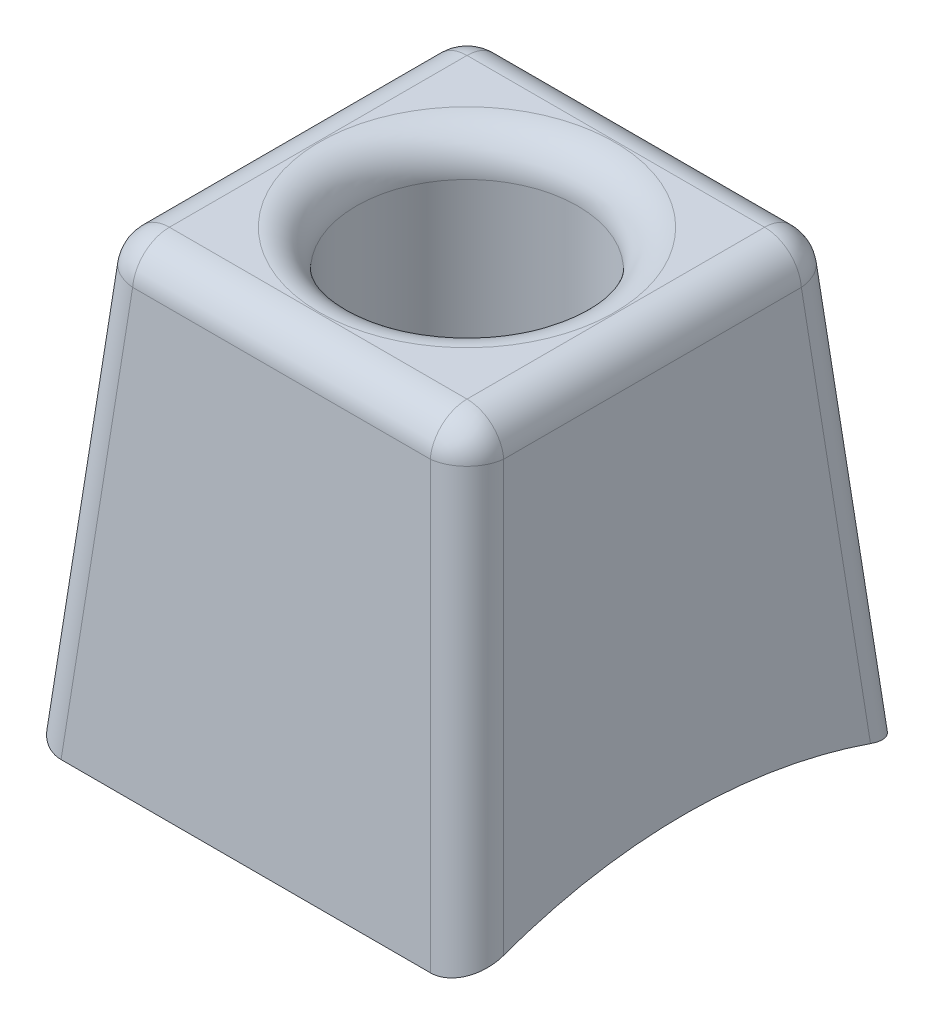
from build123d import *

# Parameters (mm, degrees)
SKETCH1_W           = 12
SKETCH1_H           = 12
BOSS_EXTRUDE1_DEPTH = 12
BOSS_EXTRUDE1_TAPER = 5
SKETCH2_R           = 3
CUT_EXTRUDE1_DEPTH  = 21.784609864
FILLET1_R           = 1
SKETCH3_R           = 16
CUT_EXTRUDE2_DEPTH  = 21.784609864


with BuildPart() as part:
    # Sketch1 → Boss-Extrude1 (new body)
    with BuildSketch(Plane(origin=(0, 0, 0), x_dir=(1, 0, 0), z_dir=(0, 1, 0))):
        with Locations((-6, 6)):
            Rectangle(SKETCH1_W, SKETCH1_H)
    extrude(amount=BOSS_EXTRUDE1_DEPTH, taper=BOSS_EXTRUDE1_TAPER)

    # Sketch2 → Cut-Extrude1 (cut, through all)
    with BuildSketch(Plane(origin=(0, 12, 0), x_dir=(1, 0, 0), z_dir=(0, 1, 0))):
        with Locations(Location((-6, 6, 0), (0, 0, 270))):
            Circle(SKETCH2_R)
    extrude(amount=-CUT_EXTRUDE1_DEPTH, mode=Mode.SUBTRACT)

    # Fillet1
    fillet1_edges = [part.edges().sort_by_distance(p)[0] for p in [
        (-10.950136038, 12, -6),
        (-6, 12, -1.049863962),
        (-6, 12, -9),
        (-1.049863962, 12, -6),
        (-6, 12, -10.950136038),
        (-0.524931981, 6, -0.524931981),
        (-11.475068019, 6, -0.524931981),
        (-11.475068019, 6, -11.475068019),
        (-0.524931981, 6, -11.475068019),
    ]]
    fillet(fillet1_edges, radius=FILLET1_R)

    # Sketch3 → Cut-Extrude2 (cut, through all)
    with BuildSketch(Plane(origin=(0, 0, 0), x_dir=(0, 0, -1), z_dir=(1, 0, 0))):
        with Locations((6, -14.832396974)):
            Circle(SKETCH3_R)
    extrude(amount=-CUT_EXTRUDE2_DEPTH, mode=Mode.SUBTRACT)


solid = part.part
